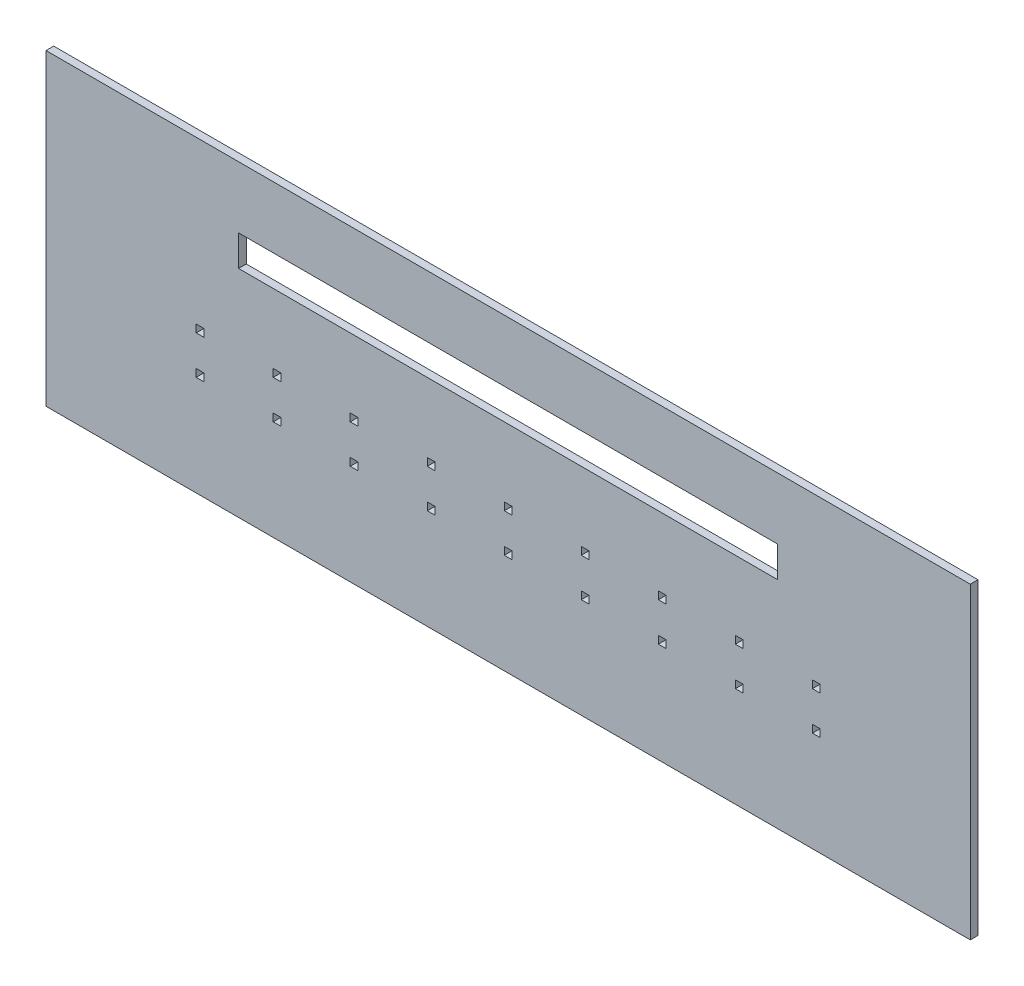
from build123d import *

# Parameters (mm, degrees)
SKETCH1_W           = 600
SKETCH1_H           = 200
EXTRUDE1_DEPTH      = 5
CUT_EXTRUDE1_REACH  = 362.59
SKETCH2_W           = 350
SKETCH2_H           = 20
CUT_EXTRUDE2_REACH  = 362.59
SKETCH4_W           = 5
SKETCH4_H           = 5
LPATTERN4_COUNT     = 5
LPATTERN4_PITCH     = 50
LPATTERN4_COL_COUNT = 5
LPATTERN4_COL_PITCH = 50


with BuildPart() as part:
    # Sketch1 → Extrude1 (new body)
    with BuildSketch(Plane.XY):
        with Locations((0, 100)):
            Rectangle(SKETCH1_W, SKETCH1_H)
    extrude(amount=EXTRUDE1_DEPTH)

    # Sketch2 → Cut-Extrude1 (cut, up to next)
    with BuildSketch(Plane.XY.offset(5), mode=Mode.PRIVATE) as cut_extrude1_sk1:
        with Locations((0, 150)):
            Rectangle(SKETCH2_W, SKETCH2_H)
    cut_extrude1_tool1 = extrude(cut_extrude1_sk1.sketch, amount=-CUT_EXTRUDE1_REACH, mode=Mode.PRIVATE) & part.part
    add(cut_extrude1_tool1.solids().sort_by_distance((0, 150, 5))[0], mode=Mode.SUBTRACT)

    # Sketch4 → Cut-Extrude2 (cut, up to next)
    with BuildSketch(Plane.XY.offset(5), mode=Mode.PRIVATE) as cut_extrude2_sk1:
        with Locations((0, 67.5)):
            Rectangle(SKETCH4_W, SKETCH4_H)
    cut_extrude2_tool1 = extrude(cut_extrude2_sk1.sketch, amount=-CUT_EXTRUDE2_REACH, mode=Mode.PRIVATE) & part.part
    # Sketch4 → Cut-Extrude2 (cut, up to next)
    with BuildSketch(Plane.XY.offset(5), mode=Mode.PRIVATE) as cut_extrude2_sk2:
        with Locations((0, 92.5)):
            Rectangle(SKETCH4_W, SKETCH4_H)
    cut_extrude2_tool2 = extrude(cut_extrude2_sk2.sketch, amount=-CUT_EXTRUDE2_REACH, mode=Mode.PRIVATE) & part.part
    cut_extrude2_1 = cut_extrude2_tool1.solids().sort_by_distance((0, 67.5, 5))[0]
    add(cut_extrude2_1, mode=Mode.SUBTRACT)
    cut_extrude2_2 = cut_extrude2_tool2.solids().sort_by_distance((0, 92.5, 5))[0]
    add(cut_extrude2_2, mode=Mode.SUBTRACT)
    cut_extrude2 = cut_extrude2_1 + cut_extrude2_2  # Cut-Extrude2 as one shape, for the pattern or mirror that repeats it

    # LPattern4: Cut-Extrude2 ×5
    with Locations(*[(-i * LPATTERN4_PITCH, 0, 0) for i in range(1, LPATTERN4_COUNT)]):
        add(cut_extrude2, mode=Mode.SUBTRACT)

    # LPattern4 col: Cut-Extrude2 ×5
    with Locations(*[(i * LPATTERN4_COL_PITCH, 0, 0) for i in range(1, LPATTERN4_COL_COUNT)]):
        add(cut_extrude2, mode=Mode.SUBTRACT)


solid = part.part
